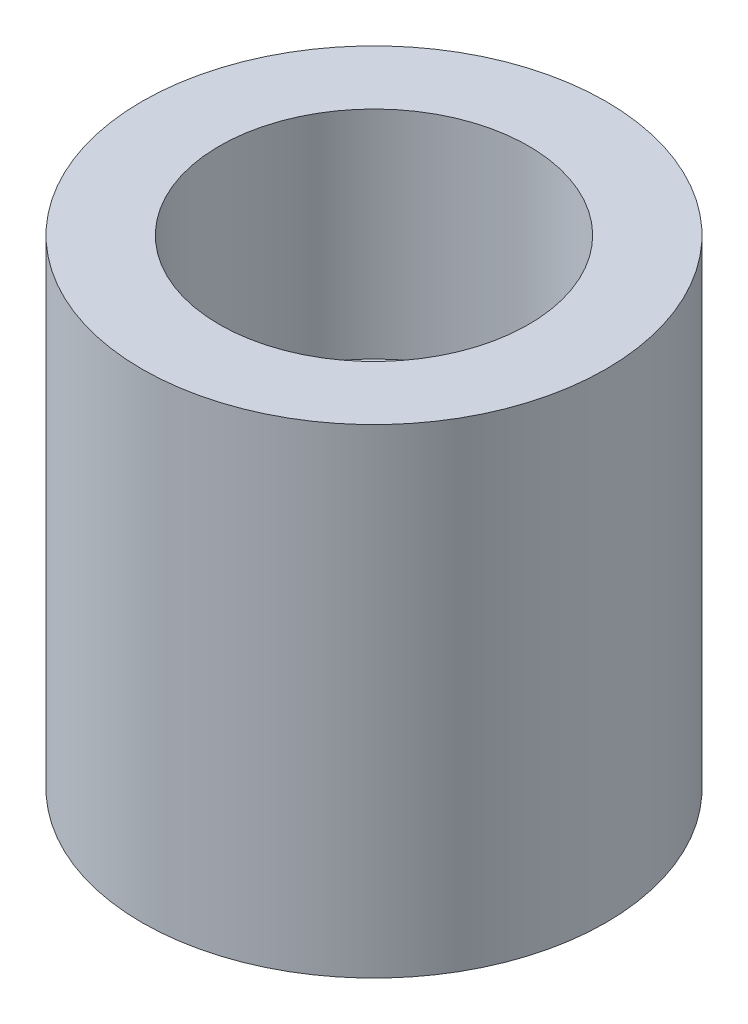
from build123d import *

# Parameters (mm, degrees)
SKETCH1_R           = 7.5
BOSS_EXTRUDE1_DEPTH = 15.5
SKETCH2_R           = 5
CUT_EXTRUDE1_DEPTH  = 7


with BuildPart() as part:
    # Sketch1 → Boss-Extrude1 (new body)
    with BuildSketch(Plane(origin=(0, 0, 0), x_dir=(1, 0, 0), z_dir=(0, 1, 0))):
        with Locations(Location((0, 0, 0), (0, 0, 270))):
            Circle(SKETCH1_R)
    extrude(amount=BOSS_EXTRUDE1_DEPTH)

    # Sketch2 → Cut-Extrude1 (cut)
    with BuildSketch(Plane(origin=(0, 15.5, 0), x_dir=(1, 0, 0), z_dir=(0, 1, 0))):
        with Locations(Location((0, 0, 0), (0, 0, 270))):
            Circle(SKETCH2_R)
    extrude(amount=-CUT_EXTRUDE1_DEPTH, mode=Mode.SUBTRACT)


solid = part.part
